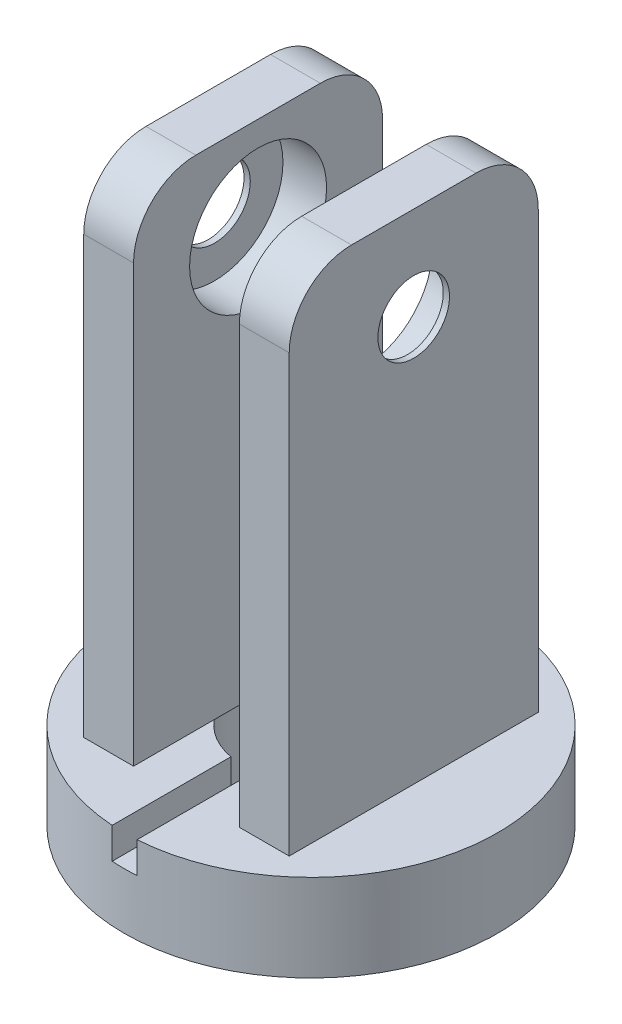
from build123d import *

# Parameters (mm, degrees)
SKETCH1_R               = 30
BOSS_EXTRUDE1_DEPTH     = 14
SKETCH2_R               = 11.05
CUT_EXTRUDE1_DEPTH      = 45.676615807
SKETCH5_W               = 8
SKETCH5_H               = 40
BOSS_EXTRUDE2_DEPTH     = 80
FILLET1_R               = 10
CUT_EXTRUDE4_START      = -5
CUT_EXTRUDE4_DEPTH      = 5
CUT_EXTRUDE5_DEPTH      = 15.5
CUT_EXTRUDE5_DEPTH_BACK = 15.5
SKETCH12_R              = 11
CUT_EXTRUDE6_REACH      = 111.079
SKETCH13_R              = 5.75


with BuildPart() as part:
    # Sketch1 → Boss-Extrude1 (new body)
    with BuildSketch(Plane(origin=(0, 0, 0), x_dir=(1, 0, 0), z_dir=(0, 1, 0))):
        with Locations(Location((0, 0, 0), (0, 0, 90))):
            Circle(SKETCH1_R)
    extrude(amount=BOSS_EXTRUDE1_DEPTH)

    # Sketch2 → Cut-Extrude1 (cut, through all)
    with BuildSketch(Plane.XZ):
        with Locations(Location((0, 0, 0), (0, 0, 270))):
            Circle(SKETCH2_R)
    extrude(amount=-CUT_EXTRUDE1_DEPTH, mode=Mode.SUBTRACT)

    # Sketch5 → Boss-Extrude2 (add)
    with BuildSketch(Plane(origin=(0, 14, 0), x_dir=(1, 0, 0), z_dir=(0, 1, 0))):
        with Locations((-12.5, 0)):
            Rectangle(SKETCH5_W, SKETCH5_H)
        with Locations((12.5, 0)):
            Rectangle(SKETCH5_W, SKETCH5_H)
    extrude(amount=BOSS_EXTRUDE2_DEPTH)

    # Fillet1
    fillet1_edges = [part.edges().sort_by_distance(p)[0] for p in [
        (-12.5, 94, 20),
        (-12.5, 94, -20),
        (12.5, 94, 20),
        (12.5, 94, -20),
    ]]
    fillet(fillet1_edges, radius=FILLET1_R)

    # Sketch8 → Cut-Extrude4 (cut)
    with BuildSketch(Plane(origin=(0, 14, 0), x_dir=(1, 0, 0), z_dir=(0, 1, 0)).offset(CUT_EXTRUDE4_START)):
        with BuildLine():
            Line((2, 29.933259094), (2, -29.933259094))
            ThreePointArc((2, -29.933259094), (0, -30), (-2, -29.933259094))
            Line((-2, -29.933259094), (-2, 29.933259094))
            ThreePointArc((-2, 29.933259094), (0, 30), (2, 29.933259094))
        make_face()
    extrude(amount=CUT_EXTRUDE4_DEPTH, mode=Mode.SUBTRACT)

    # Sketch12 → Cut-Extrude5 (cut, two sides: drawn at the far end of the back side and taken through both)
    with BuildSketch(Plane(origin=(0, 0, 0), x_dir=(0, 0, -1), z_dir=(1, 0, 0)).offset(-CUT_EXTRUDE5_DEPTH_BACK)):
        with Locations((0, 79)):
            Circle(SKETCH12_R)
    extrude(amount=CUT_EXTRUDE5_DEPTH + CUT_EXTRUDE5_DEPTH_BACK, mode=Mode.SUBTRACT)

    # Cut-Extrude6: up to this face of the body (flat: up to its plane)
    cut_extrude6_end = Plane(part.part.faces().sort_by_distance((16.5, 53.48656843, 0))[0])
    # Sketch13 → Cut-Extrude6 (cut, up to the picked face)
    with BuildSketch(Plane.ZY.offset(16.5), mode=Mode.PRIVATE) as cut_extrude6_sk1:
        with Locations((0, 79)):
            Circle(SKETCH13_R)
    cut_extrude6_tool1 = split(extrude(cut_extrude6_sk1.sketch, amount=-CUT_EXTRUDE6_REACH, mode=Mode.PRIVATE), bisect_by=cut_extrude6_end, keep=Keep.BOTH, mode=Mode.PRIVATE)
    add(cut_extrude6_tool1.solids().sort_by(Axis((-16.5, 79, 0), (1, 0, 0)))[0], mode=Mode.SUBTRACT)


solid = part.part
